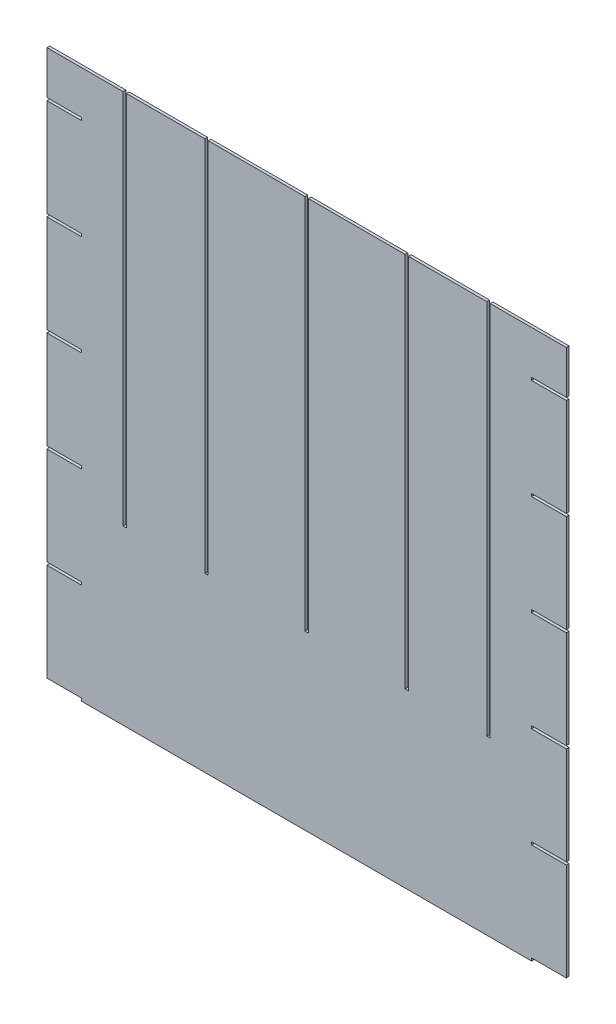
from build123d import *

# Parameters (mm, degrees)
BOSS_EXTRUDE1_DEPTH = 3


with BuildPart() as part:
    # Model → Boss-Extrude1 (new body)
    with BuildSketch(Plane.XY):
        Polygon((-284.099225299, 3), (-245.979700014, 3), (-245.979700014, 0), (245.979700014, 0), (245.979700014, 3), (284.099225299, 3), (284.099225299, 110), (245.979700014, 110), (245.979700014, 113), (284.099225299, 113), (284.099225299, 220), (245.979700014, 220), (245.979700014, 223), (284.099225299, 223), (284.099225299, 330), (245.979700014, 330), (245.979700014, 333), (284.099225299, 333), (284.099225299, 440), (245.979700014, 440), (245.979700014, 443), (284.099225299, 443), (284.099225299, 550), (245.979700014, 550), (245.979700014, 553), (284.099225299, 553), (284.099225299, 600.248156907), (200.722661621, 600.248156907), (200.722661621, 188.610331254), (197.122661621, 188.610331254), (197.122661621, 600.248156907), (111.3, 600.248156907), (111.3, 188.610331254), (107.7, 188.610331254), (107.7, 600.248156907), (1.8, 600.248156907), (1.8, 188.610331254), (-1.8, 188.610331254), (-1.8, 600.248156907), (-107.7, 600.248156907), (-107.7, 188.610331254), (-111.3, 188.610331254), (-111.3, 600.248156907), (-197.122661621, 600.248156907), (-197.122661621, 188.610331254), (-200.722661621, 188.610331254), (-200.722661621, 600.248156907), (-284.099225299, 600.248156907), (-284.099225299, 553), (-245.979700014, 553), (-245.979700014, 550), (-284.099225299, 550), (-284.099225299, 443), (-245.979700014, 443), (-245.979700014, 440), (-284.099225299, 440), (-284.099225299, 333), (-245.979700014, 333), (-245.979700014, 330), (-284.099225299, 330), (-284.099225299, 223), (-245.979700014, 223), (-245.979700014, 220), (-284.099225299, 220), (-284.099225299, 113), (-245.979700014, 113), (-245.979700014, 110), (-284.099225299, 110), align=None)
    extrude(amount=BOSS_EXTRUDE1_DEPTH)


solid = part.part
